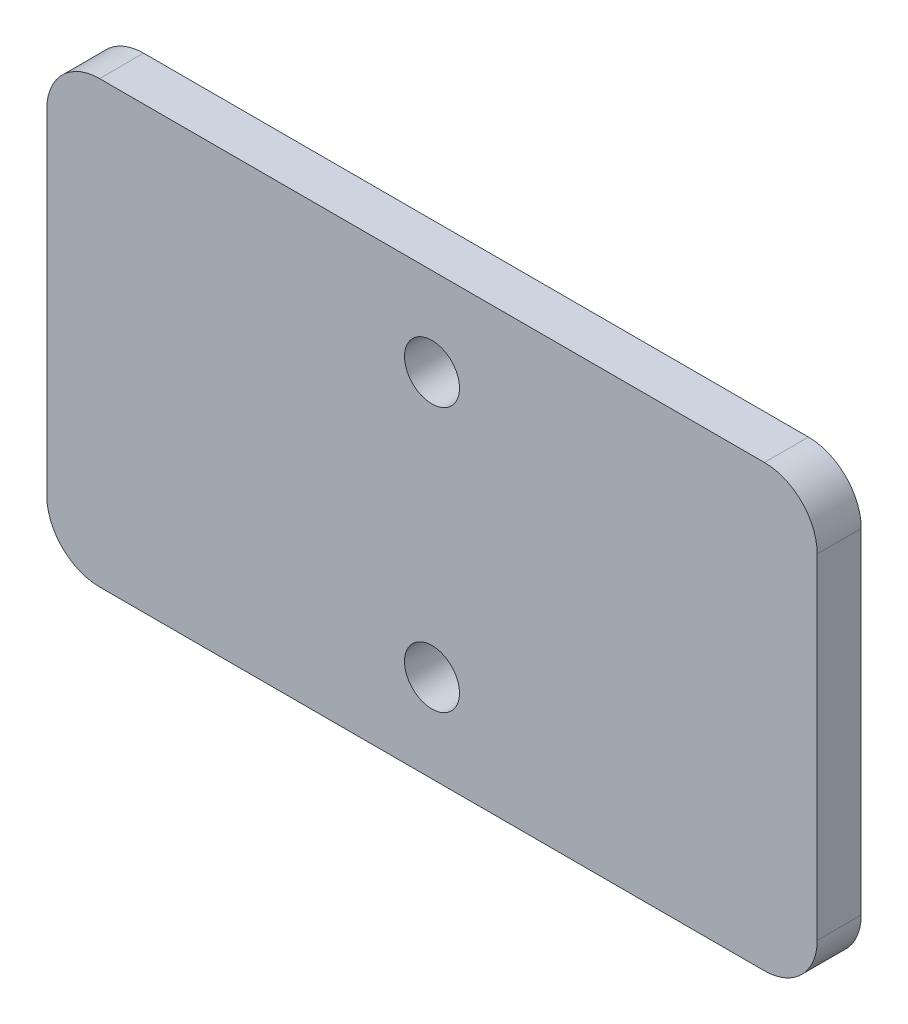
from build123d import *

# Parameters (mm, degrees)
ESQUISSE1_W        = 175
ESQUISSE1_H        = 100
ESQUISSE1_R        = 6.25
BOSS_EXTRU_1_DEPTH = 10
CONG_1_R           = 12


with BuildPart() as part:
    # Esquisse1 → Boss.-Extru.1 (new body)
    with BuildSketch(Plane.XY):
        Rectangle(ESQUISSE1_W, ESQUISSE1_H)
        with Locations((0, 30)):
            Circle(ESQUISSE1_R, mode=Mode.SUBTRACT)
        with Locations((0, -30)):
            Circle(ESQUISSE1_R, mode=Mode.SUBTRACT)
    extrude(amount=BOSS_EXTRU_1_DEPTH)

    # Congé1
    cong_1_edges = [part.edges().sort_by_distance(p)[0] for p in [
        (87.5, -50, 5),
        (-87.5, -50, 5),
        (-87.5, 50, 5),
        (87.5, 50, 5),
    ]]
    fillet(cong_1_edges, radius=CONG_1_R)


solid = part.part
